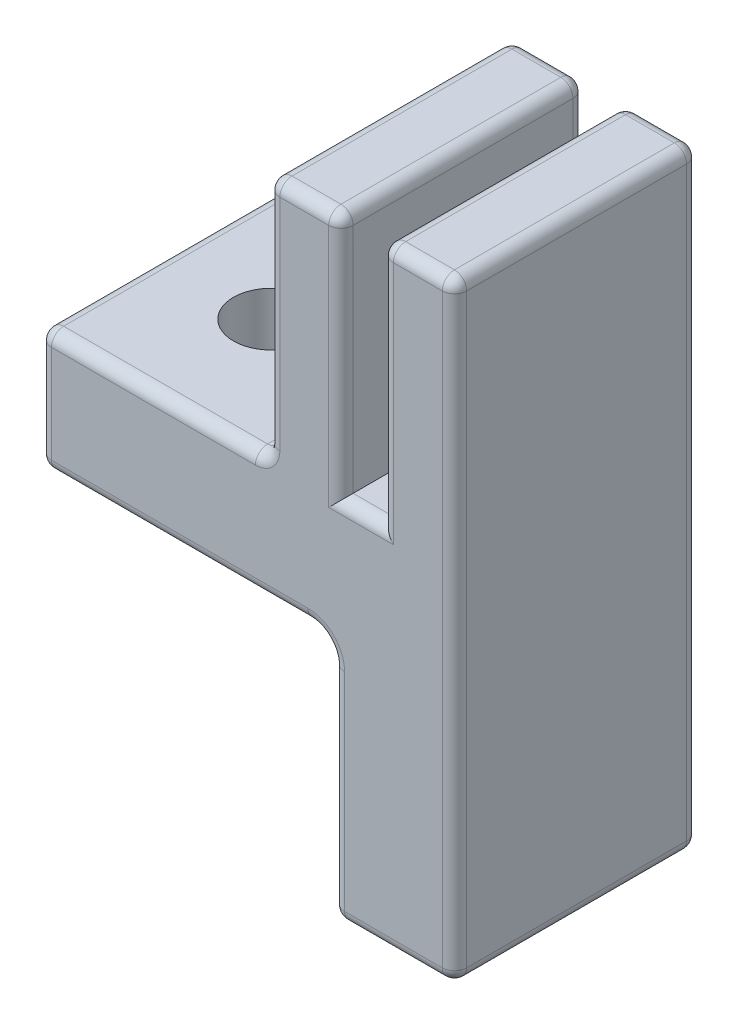
from build123d import *

# Parameters (mm, degrees)
SKETCH1_W           = 3
SKETCH1_H           = 10
BOSS_EXTRUDE1_DEPTH = 10
SKETCH3_R           = 1.55
CUT_EXTRUDE1_DEPTH  = 10
FILLET1_R           = 1
FILLET2_R           = 0.5


with BuildPart() as part:
    # Sketch1 → Boss-Extrude1 (new body)
    with BuildSketch(Plane.XY):
        Polygon((6, -5), (6, 5), (-6, 5), (-6, 10), (11, 10), (11, -5), align=None)
        with Locations((4.85, 15)):
            Rectangle(SKETCH1_W, SKETCH1_H)
        with Locations((9.5, 15)):
            Rectangle(SKETCH1_W, SKETCH1_H)
    extrude(amount=BOSS_EXTRUDE1_DEPTH)

    # Sketch3 → Cut-Extrude1 (cut)
    with BuildSketch(Plane.XZ.offset(-5)):
        with Locations(Location((-1.5, 5, 0), (0, 0, 270))):
            Circle(SKETCH3_R)
    extrude(amount=-CUT_EXTRUDE1_DEPTH, mode=Mode.SUBTRACT)

    # Fillet1
    fillet1_edges = [part.edges().sort_by_distance(p)[0] for p in [
        (6, 5, 5),
    ]]
    fillet(fillet1_edges, radius=FILLET1_R)

    # Fillet2
    fillet2_edges = [part.edges().sort_by_distance(p)[0] for p in [
        (8.5, -5, 10),
        (-0.5, 5, 0),
        (-6, 7.5, 0),
        (11, 7.5, 10),
        (-1.325, 10, 0),
        (3.35, 15, 0),
        (4.85, 20, 0),
        (6.35, 15, 0),
        (7.175, 10, 0),
        (8, 15, 0),
        (9.5, 20, 0),
        (11, 7.5, 0),
        (8.5, -5, 0),
        (6, -0.5, 0),
        (9.5, 20, 10),
        (-6, 5, 5),
        (-6, 10, 5),
        (3.35, 10, 5),
        (3.35, 20, 5),
        (6.35, 20, 5),
        (8, 20, 5),
        (11, 20, 5),
        (11, -5, 5),
        (6, -5, 5),
        (8, 15, 10),
        (7.175, 10, 10),
        (6.35, 15, 10),
        (4.85, 20, 10),
        (5.707106781, 4.707106781, 0),
        (5.707106781, 4.707106781, 10),
        (3.35, 15, 10),
        (6, -0.5, 10),
        (-1.325, 10, 10),
        (-6, 7.5, 10),
        (-0.5, 5, 10),
    ]]
    fillet(fillet2_edges, radius=FILLET2_R)


solid = part.part
